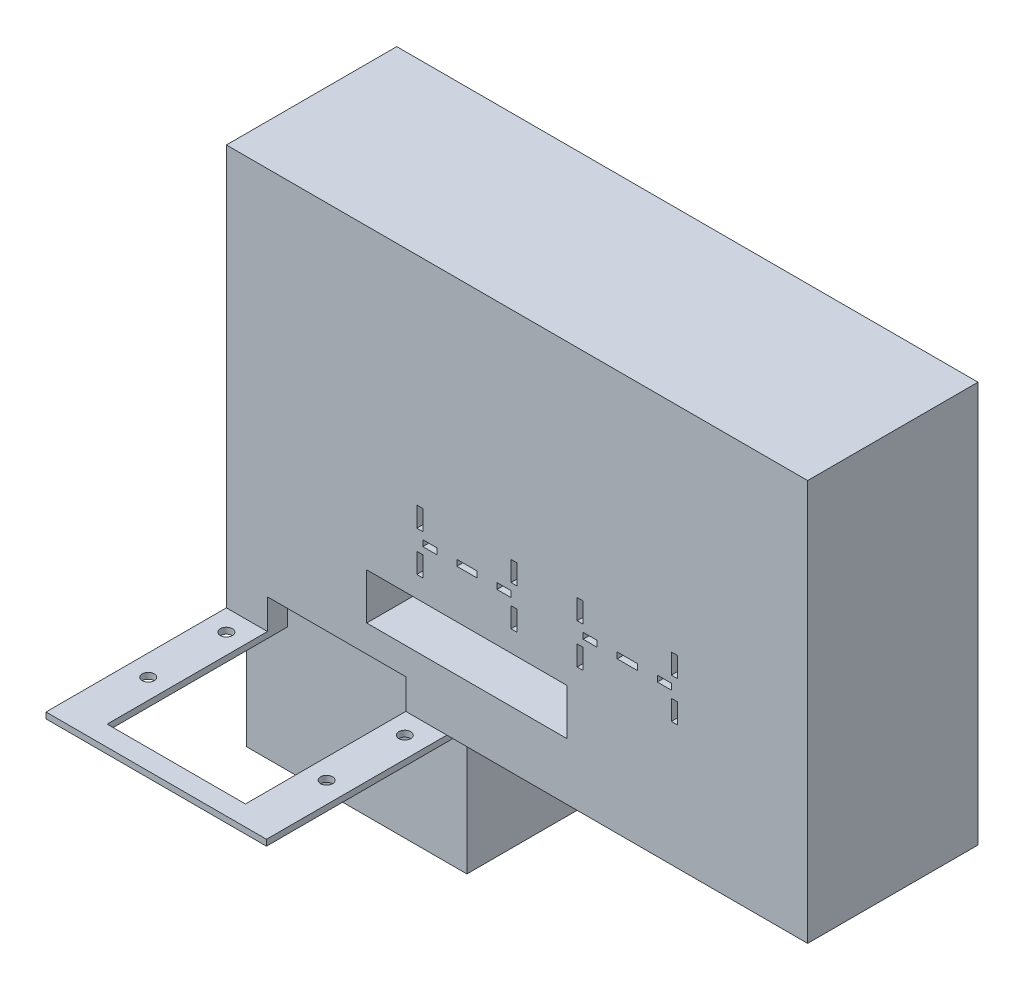
from build123d import *

# Parameters (mm, degrees)
CROQUIS1_W              = 110
CROQUIS1_H              = 65
SALIENTE_EXTRUIR1_DEPTH = 75
CROQUIS3_W              = 110
CROQUIS3_H              = 3
SALIENTE_EXTRUIR2_DEPTH = 70
CROQUIS4_R              = 3
CORTAR_EXTRUIR1_DEPTH   = 70
SALIENTE_EXTRUIR3_DEPTH = 3
CROQUIS7_W              = 290
CROQUIS7_H              = 85
SALIENTE_EXTRUIR4_DEPTH = 200
CROQUIS8_W              = 69
CROQUIS8_H              = 15
CORTAR_EXTRUIR2_DEPTH   = 10
CORTAR_EXTRUIR3_DEPTH   = 50
CROQUIS12_W             = 7
CROQUIS12_H             = 3
CROQUIS12_W_2           = 3
CROQUIS12_H_2           = 10
CROQUIS12_W_3           = 10
CORTAR_EXTRUIR4_DEPTH   = 3


with BuildPart() as part:
    # Croquis1 → Saliente-Extruir1 (new body)
    with BuildSketch(Plane.XY):
        with Locations((-30.634930344, 26.158405172)):
            Rectangle(CROQUIS1_W, CROQUIS1_H)
    extrude(amount=SALIENTE_EXTRUIR1_DEPTH)

    # Croquis3 → Saliente-Extruir2 (add)
    with BuildSketch(Plane.XY.offset(75)):
        with Locations((-30.634930344, 57.158405172)):
            Rectangle(CROQUIS3_W, CROQUIS3_H)
    extrude(amount=SALIENTE_EXTRUIR2_DEPTH)

    # Croquis4 → Cortar-Extruir1 (cut)
    with BuildSketch(Plane.XZ.offset(-55.658405172)):
        with Locations(Location((-75.134930344, 134.5, 0), (0, 0, 270))):
            Circle(CROQUIS4_R)
        with Locations(Location((-75.134930344, 95.5, 0), (0, 0, 270))):
            Circle(CROQUIS4_R)
        with Locations(Location((13.865069656, 134.5, 0), (0, 0, 270))):
            Circle(CROQUIS4_R)
        with Locations(Location((13.865069656, 95.5, 0), (0, 0, 270))):
            Circle(CROQUIS4_R)
        Polygon((-65.134930344, 134.5), (-65.134930344, 75), (3.865069656, 75), (3.865069656, 138), (3.865069656, 145), (-65.134930344, 145), align=None)
    extrude(amount=-CORTAR_EXTRUIR1_DEPTH, mode=Mode.SUBTRACT)

    # Croquis6 → Saliente-Extruir3 (add)
    with BuildSketch(Plane(origin=(0, 58.658405172, 0), x_dir=(1, 0, 0), z_dir=(0, 1, 0))):
        Polygon((-85.634930344, -145), (-85.634930344, -175), (24.365069656, -175), (24.365069656, -145), (3.865069656, -145), (3.865069656, -165), (-65.134930344, -165), (-65.134930344, -145), align=None)
    extrude(amount=-SALIENTE_EXTRUIR3_DEPTH)

    # Croquis7 → Saliente-Extruir4 (add)
    with BuildSketch(Plane(origin=(0, 58.658405172, 0), x_dir=(1, 0, 0), z_dir=(0, 1, 0))):
        with Locations((59.365069656, -42.5)):
            Rectangle(CROQUIS7_W, CROQUIS7_H)
    extrude(amount=SALIENTE_EXTRUIR4_DEPTH)

    # Croquis8 → Cortar-Extruir2 (cut)
    with BuildSketch(Plane.XY.offset(85)):
        with Locations((-30.634930344, 66.158405172)):
            Rectangle(CROQUIS8_W, CROQUIS8_H)
    extrude(amount=-CORTAR_EXTRUIR2_DEPTH, mode=Mode.SUBTRACT)

    # Croquis10 → Cortar-Extruir3 (cut)
    with BuildSketch(Plane.XY.offset(85)):
        Polygon((-0.634930344, 87.0941562), (-15.634930344, 87.0941562), (-15.634930344, 110.0941562), (-0.634930344, 110.0941562), (69.365069656, 110.0941562), (84.365069656, 110.0941562), (84.365069656, 87.0941562), (69.365069656, 87.0941562), align=None)
    extrude(amount=-CORTAR_EXTRUIR3_DEPTH, mode=Mode.SUBTRACT)

    # Croquis12 → Cortar-Extruir4 (cut)
    with BuildSketch(Plane.XY.offset(85)):
        with Locations((15.865069656, 135.5941562)):
            Rectangle(CROQUIS12_W, CROQUIS12_H)
        with Locations((10.865069656, 125.5941562)):
            Rectangle(CROQUIS12_W_2, CROQUIS12_H_2)
        with Locations((57.865069656, 145.5941562)):
            Rectangle(CROQUIS12_W_2, CROQUIS12_H_2)
        with Locations((57.865069656, 125.5941562)):
            Rectangle(CROQUIS12_W_2, CROQUIS12_H_2)
        with Locations((52.865069656, 135.5941562)):
            Rectangle(CROQUIS12_W, CROQUIS12_H)
        with Locations((10.865069656, 145.5941562)):
            Rectangle(CROQUIS12_W_2, CROQUIS12_H_2)
        with Locations((34.365069656, 135.5941562)):
            Rectangle(CROQUIS12_W_3, CROQUIS12_H)
        with Locations((114.365069656, 135.5941562)):
            Rectangle(CROQUIS12_W_3, CROQUIS12_H)
        with Locations((132.865069656, 135.5941562)):
            Rectangle(CROQUIS12_W, CROQUIS12_H)
        with Locations((90.865069656, 145.5941562)):
            Rectangle(CROQUIS12_W_2, CROQUIS12_H_2)
        with Locations((90.865069656, 125.5941562)):
            Rectangle(CROQUIS12_W_2, CROQUIS12_H_2)
        with Locations((95.865069656, 135.5941562)):
            Rectangle(CROQUIS12_W, CROQUIS12_H)
        with Locations((137.865069656, 145.5941562)):
            Rectangle(CROQUIS12_W_2, CROQUIS12_H_2)
        with Locations((137.865069656, 125.5941562)):
            Rectangle(CROQUIS12_W_2, CROQUIS12_H_2)
    extrude(amount=-CORTAR_EXTRUIR4_DEPTH, mode=Mode.SUBTRACT)


solid = part.part
